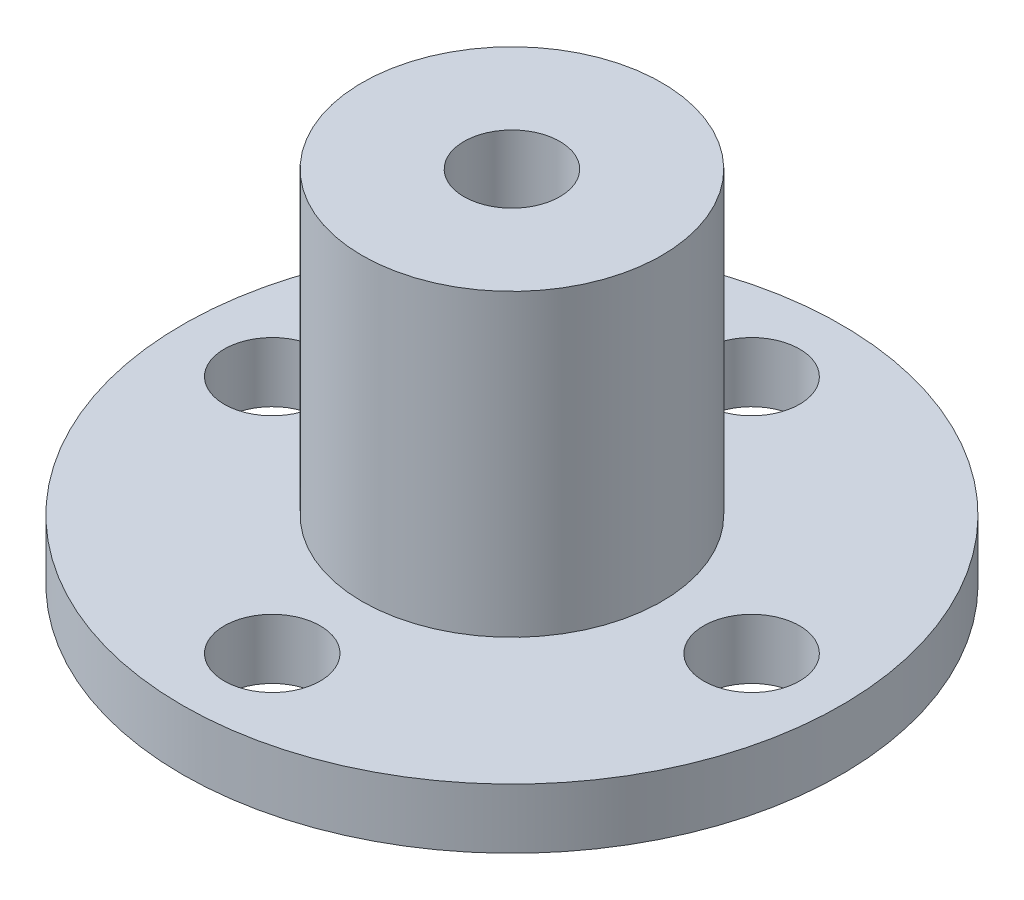
from build123d import *

# Parameters (mm, degrees)
SKETCH_1_R      = 5
SKETCH_1_R_2    = 1.6
EXTRUDE_1_DEPTH = 10
SKETCH_1_3_R    = 5
EXTRUDE_2_DEPTH = 2
SKETCH_1_4_R    = 11
EXTRUDE_3_DEPTH = 2


with BuildPart() as part:
    # 草图1 → 凸台-拉伸1 (new body)
    with BuildSketch(Plane(origin=(0, 0, 0), x_dir=(1, 0, 0), z_dir=(0, 1, 0))):
        Circle(SKETCH_1_R)
        Circle(SKETCH_1_R_2, mode=Mode.SUBTRACT)
    extrude(amount=EXTRUDE_1_DEPTH)


with BuildPart() as body_2:
    # 草图1<3> → 凸台-拉伸2 (new body)
    with BuildSketch(Plane(origin=(0, 0, 0), x_dir=(1, 0, 0), z_dir=(0, 1, 0))):
        with BuildLine():
            ThreePointArc((7.84, -1.591979899), (6.4, 0), (7.84, 1.591979899))
            ThreePointArc((7.84, 1.591979899), (5.656854249, 5.656854249), (1.591979899, 7.84))
            ThreePointArc((1.591979899, 7.84), (0, 6.4), (-1.591979899, 7.84))
            ThreePointArc((-1.591979899, 7.84), (-5.656854249, 5.656854249), (-7.84, 1.591979899))
            ThreePointArc((-7.84, 1.591979899), (-6.813408242, 1.073312629), (-6.4, 0))
            ThreePointArc((-6.4, 0), (-6.813408242, -1.073312629), (-7.84, -1.591979899))
            ThreePointArc((-7.84, -1.591979899), (-5.656854249, -5.656854249), (-1.591979899, -7.84))
            ThreePointArc((-1.591979899, -7.84), (0, -6.4), (1.591979899, -7.84))
            ThreePointArc((1.591979899, -7.84), (5.656854249, -5.656854249), (7.84, -1.591979899))
        make_face()
        Circle(SKETCH_1_3_R, mode=Mode.SUBTRACT)
    extrude(amount=-EXTRUDE_2_DEPTH)

    # 草图1<4> → 凸台-拉伸3 (add)
    with BuildSketch(Plane(origin=(0, 0, 0), x_dir=(1, 0, 0), z_dir=(0, 1, 0))):
        Circle(SKETCH_1_4_R)
        with BuildLine():
            ThreePointArc((1.591979899, 7.84), (5.656854249, 5.656854249), (7.84, 1.591979899))
            ThreePointArc((7.84, 1.591979899), (9.073312629, 1.186591758), (9.6, 0))
            ThreePointArc((9.6, 0), (9.073312629, -1.186591758), (7.84, -1.591979899))
            ThreePointArc((7.84, -1.591979899), (5.656854249, -5.656854249), (1.591979899, -7.84))
            ThreePointArc((1.591979899, -7.84), (1.597993717, -7.91989956), (1.6, -8))
            ThreePointArc((1.6, -8), (-0.08010044, -9.597993717), (-1.591979899, -7.84))
            ThreePointArc((-1.591979899, -7.84), (-5.656854249, -5.656854249), (-7.84, -1.591979899))
            ThreePointArc((-7.84, -1.591979899), (-9.6, 0), (-7.84, 1.591979899))
            ThreePointArc((-7.84, 1.591979899), (-5.656854249, 5.656854249), (-1.591979899, 7.84))
            ThreePointArc((-1.591979899, 7.84), (-0.08010044, 9.597993717), (1.6, 8))
            ThreePointArc((1.6, 8), (1.597993717, 7.91989956), (1.591979899, 7.84))
        make_face(mode=Mode.SUBTRACT)
    extrude(amount=-EXTRUDE_3_DEPTH)


solid = Compound([part.part, body_2.part])
